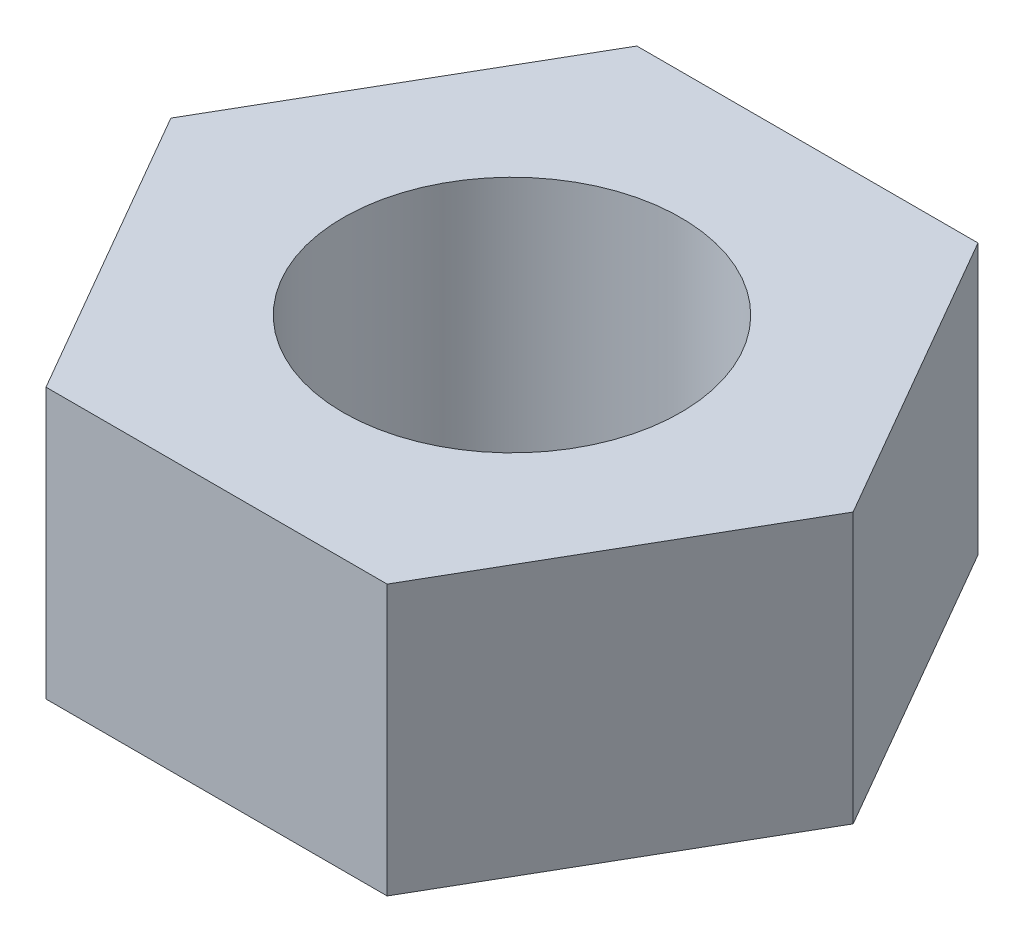
from build123d import *

# Parameters (mm, degrees)
SKETCH1_R           = 2
BOSS_EXTRUDE1_DEPTH = 3.2


with BuildPart() as part:
    # Sketch1 → Boss-Extrude1 (new body)
    with BuildSketch(Plane(origin=(0, 0, 0), x_dir=(1, 0, 0), z_dir=(0, 1, 0))):
        Polygon((4.041451884, 0), (2.020725942, 3.5), (-2.020725942, 3.5), (-4.041451884, 0), (-2.020725942, -3.5), (2.020725942, -3.5), align=None)
        with Locations(Location((0, 0, 0), (0, 0, 270))):
            Circle(SKETCH1_R, mode=Mode.SUBTRACT)
    extrude(amount=BOSS_EXTRUDE1_DEPTH)


solid = part.part
